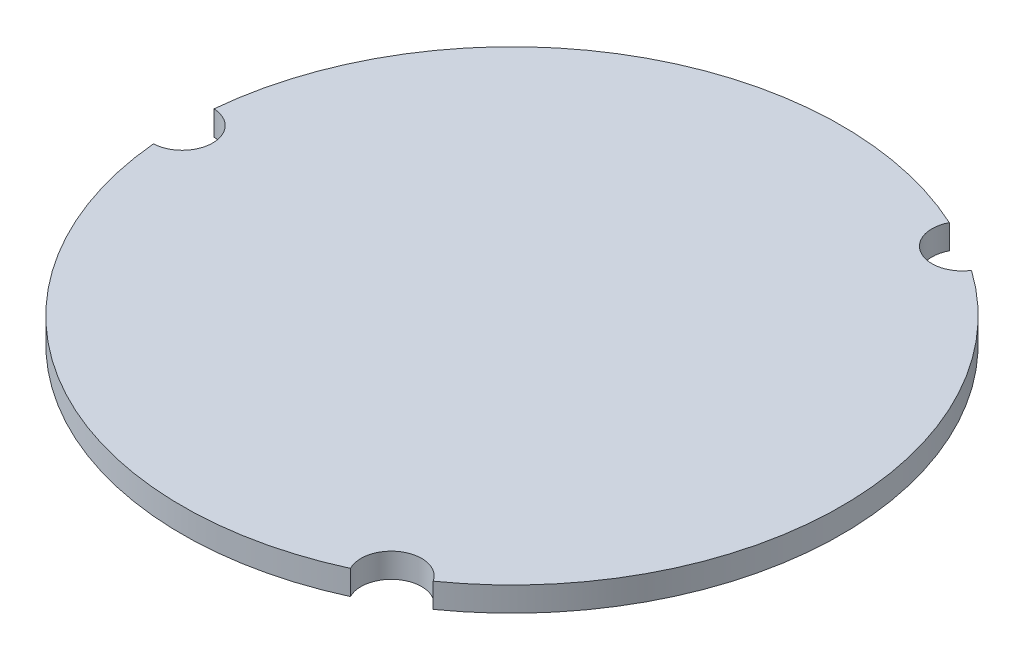
from build123d import *

# Parameters (mm, degrees)
BOSS_EXTRU_1_DEPTH = 2.5


with BuildPart() as part:
    # Esquisse1 → Boss.-Extru.1 (new body)
    with BuildSketch(Plane(origin=(0, 0, 0), x_dir=(1, 0, 0), z_dir=(0, 1, 0))):
        with BuildLine():
            Line((33.7, 0), (-30.6, 0))
            ThreePointArc((-30.6, 0), (-31.458125453, -2.141027444), (-33.557418398, -3.09671931))
            ThreePointArc((-33.557418398, -3.09671931), (-16.85, -29.185056108), (14.096871608, -30.609936473))
            ThreePointArc((14.096871608, -30.609936473), (15.3, -26.500377356), (19.46054679, -27.513217163))
            ThreePointArc((19.46054679, -27.513217163), (29.929169942, -15.489828488), (33.7, 0))
        make_face()
        with BuildLine():
            ThreePointArc((-33.557418398, 3.09671931), (-31.458125453, 2.141027444), (-30.6, 0))
            Line((-30.6, 0), (33.7, 0))
            ThreePointArc((33.7, 0), (29.929169942, 15.489828488), (19.46054679, 27.513217163))
            ThreePointArc((19.46054679, 27.513217163), (15.3, 26.500377356), (14.096871608, 30.609936473))
            ThreePointArc((14.096871608, 30.609936473), (-16.85, 29.185056108), (-33.557418398, 3.09671931))
        make_face()
    extrude(amount=BOSS_EXTRU_1_DEPTH)


solid = part.part
